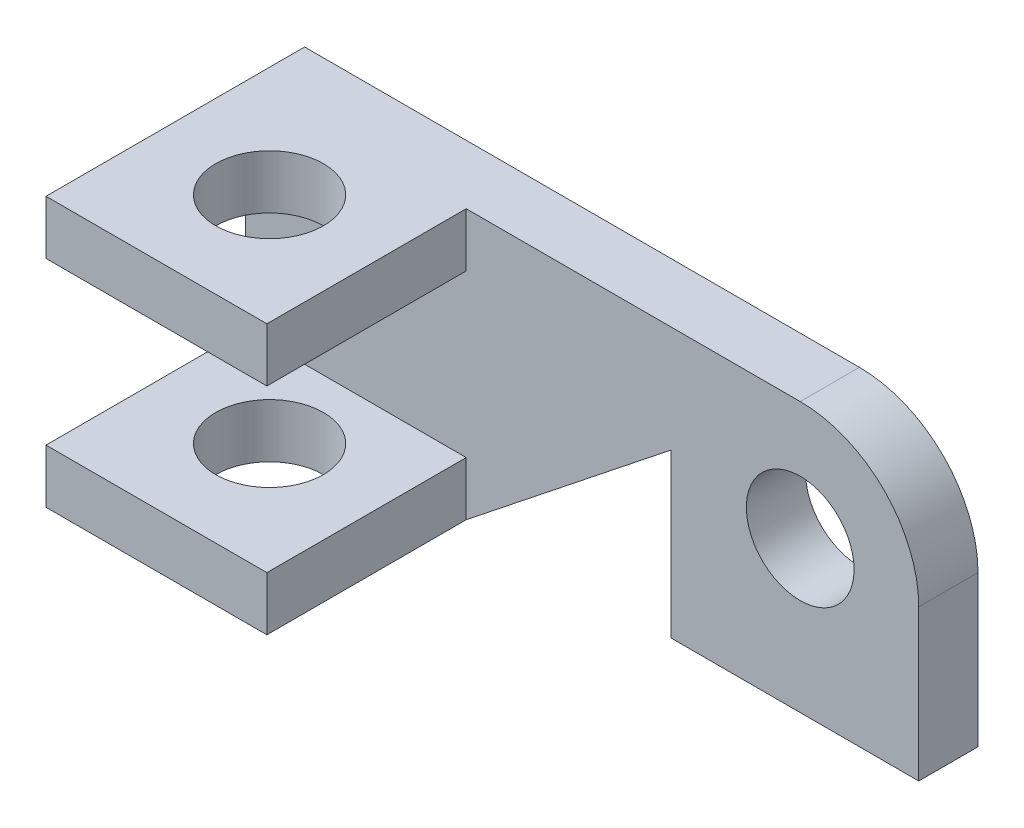
from build123d import *

# Parameters (mm, degrees)
BOSS_EXTRUDE1_DEPTH = 11000
SKETCH1_5_R         = 10000
CUT_EXTRUDE1_DEPTH  = 135078.755385556
SKETCH2_W           = 41000
SKETCH2_H           = 10000
BOSS_EXTRUDE5_DEPTH = 37000
SKETCH3_R           = 10000
CUT_EXTRUDE2_DEPTH  = 142931.052823051


with BuildPart() as part:
    # Sketch1 → Boss-Extrude1 (new body)
    with BuildSketch(Plane.XY):
        with BuildLine():
            Line((0, 0), (41000, 0))
            Line((41000, 0), (79000, 30197.419778423))
            Line((79000, 30197.419778423), (79000, 0))
            Line((79000, 0), (125000, 0))
            Line((125000, 0), (125000, 28000))
            ThreePointArc((125000, 28000), (118556.349186104, 43556.349186104), (103000, 50000))
            Line((103000, 50000), (0, 50000))
            Line((0, 50000), (0, 0))
        make_face()
    extrude(amount=BOSS_EXTRUDE1_DEPTH)

    # Sketch1<5> → Cut-Extrude1 (cut, through all)
    with BuildSketch(Plane.XY):
        with Locations((103000, 28000)):
            Circle(SKETCH1_5_R)
    extrude(amount=CUT_EXTRUDE1_DEPTH, mode=Mode.SUBTRACT)

    # Sketch2 → Boss-Extrude5 (add)
    with BuildSketch(Plane.XY.offset(11000)):
        with Locations((20500, 5000)):
            Rectangle(SKETCH2_W, SKETCH2_H)
        with Locations((20500, 45000)):
            Rectangle(SKETCH2_W, SKETCH2_H)
    extrude(amount=BOSS_EXTRUDE5_DEPTH)

    # Sketch3 → Cut-Extrude2 (cut, through all)
    with BuildSketch(Plane.XZ):
        with Locations((20500, 27000)):
            Circle(SKETCH3_R)
    extrude(amount=-CUT_EXTRUDE2_DEPTH, mode=Mode.SUBTRACT)


solid = part.part
